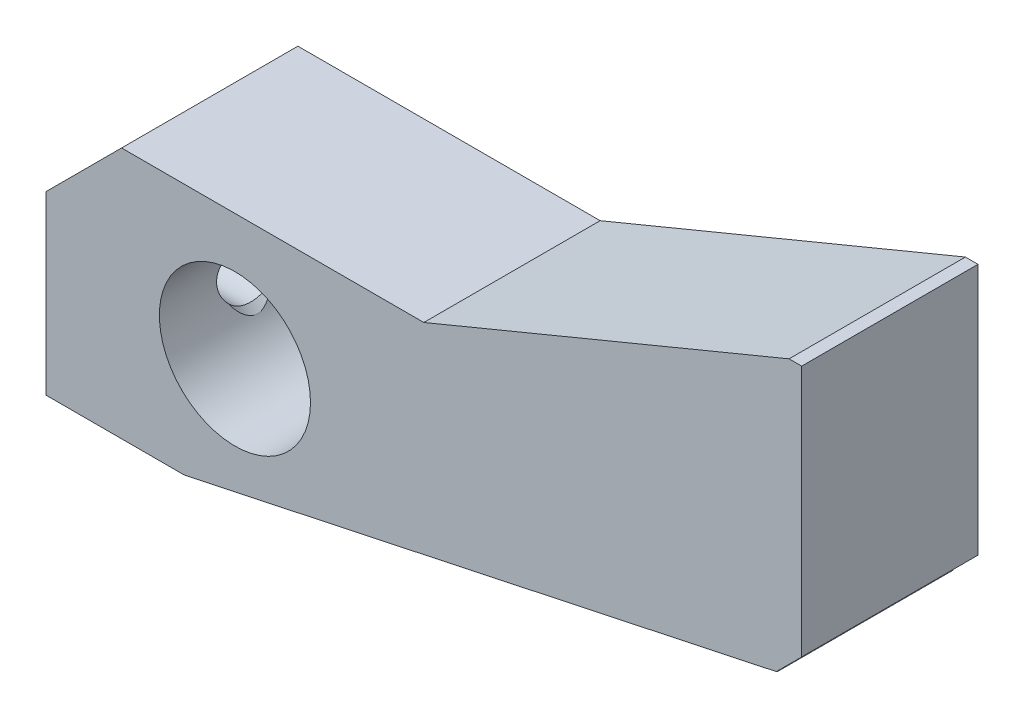
from build123d import *

# Parameters (mm, degrees)
BOSS_EXTRUDE1_DEPTH      = 3.5
BOSS_EXTRUDE1_DEPTH_BACK = 3.5
CUT_EXTRUDE1_DEPTH       = 3.5
CUT_EXTRUDE1_DEPTH_BACK  = 3.5
SKETCH2_R                = 3


with BuildPart() as part:
    # Sketch1 → Boss-Extrude1 (new, two sides: drawn at the far end of the back side and taken through both)
    with BuildSketch(Plane.XY.offset(-BOSS_EXTRUDE1_DEPTH_BACK)):
        Polygon((0, 25), (0, 18), (5.5, 18), (29.023150547, 23), (29, 23), (30, 24), (30, 34), (29.5, 34), (15, 28), (3, 28), align=None)
    extrude(amount=BOSS_EXTRUDE1_DEPTH + BOSS_EXTRUDE1_DEPTH_BACK)

    # Sketch2 → Cut-Extrude1 (cut, two sides: drawn at the far end of the back side and taken through both)
    with BuildSketch(Plane.XY.offset(-CUT_EXTRUDE1_DEPTH_BACK)):
        with Locations((7.5, 23)):
            Circle(SKETCH2_R)
    extrude(amount=CUT_EXTRUDE1_DEPTH + CUT_EXTRUDE1_DEPTH_BACK, mode=Mode.SUBTRACT)

    # Sketch3 → Cut-Revolve1 (revolve, cut)
    with BuildSketch(Plane.XY):
        Polygon((4.901923789, 23), (4.901923789, 21.5), (4.631423789, 21.7705), (0.2705, 21.7705), (0, 21.5), (0, 23), align=None)
    revolve(axis=Axis((0, 23, 0), (1, 0, 0)), mode=Mode.SUBTRACT)

    # Sketch4 → Cut-Revolve2 (revolve, cut)
    with BuildSketch(Plane.XY):
        Polygon((22.955657634, 25.799676948), (25.401026635, 26.319456175), (26.085657632, 23.098520573), (27.951102449, 21.887086545), (23.967294024, 21.040301924), align=None)
    revolve(axis=Axis((23.967294024, 21.040301924, 0), (-0.20791169081768215, 0.9781476007338221, 0)), mode=Mode.SUBTRACT)


solid = part.part
